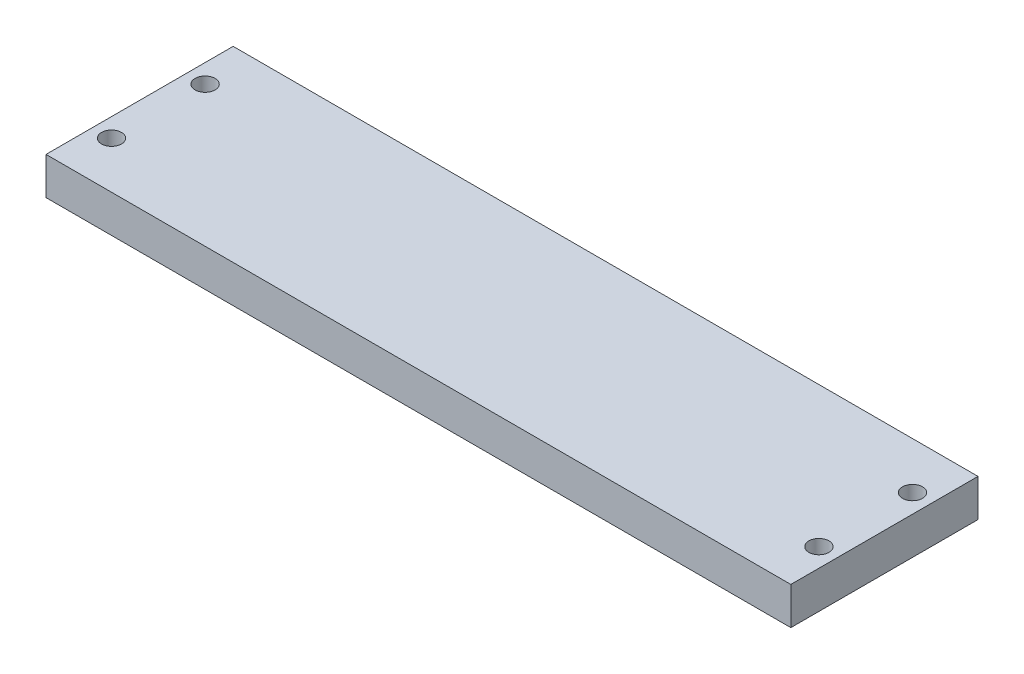
from build123d import *

# Parameters (mm, degrees)
SKETCH2_W                        = 252.7
SKETCH2_H                        = 63.5
BOSS_EXTRUDE2_DEPTH              = 12.7
TAP_DRILL_FOR_M8X1_25_TAP1_D     = 6.8
TAP_DRILL_FOR_M8X1_25_TAP1_DEPTH = 40
TAP_DRILL_FOR_M8X1_25_TAP1_TIP   = 2.042926105


with BuildPart() as part:
    # Sketch2 → Boss-Extrude2 (new body)
    with BuildSketch(Plane(origin=(0, 0, 0), x_dir=(1, 0, 0), z_dir=(0, 1, 0))):
        with Locations((-5.813963312, -217.324932993)):
            Rectangle(SKETCH2_W, SKETCH2_H)
    extrude(amount=BOSS_EXTRUDE2_DEPTH)

    # Tap Drill for M8x1.25 Tap1
    with Locations(Plane(origin=(-125.813963312, 12.7, 201.449932993), x_dir=(0, 0, 1), z_dir=(0, 1, 0))):
        with Locations((0, 0), (31.75, 0), (0, 240), (31.75, 240)):
            Hole(TAP_DRILL_FOR_M8X1_25_TAP1_D / 2, depth=TAP_DRILL_FOR_M8X1_25_TAP1_DEPTH)
            with Locations((0, 0, -(TAP_DRILL_FOR_M8X1_25_TAP1_DEPTH + TAP_DRILL_FOR_M8X1_25_TAP1_TIP / 2))):  # 118° drill point
                Cone(0, TAP_DRILL_FOR_M8X1_25_TAP1_D / 2, TAP_DRILL_FOR_M8X1_25_TAP1_TIP, mode=Mode.SUBTRACT)


solid = part.part
